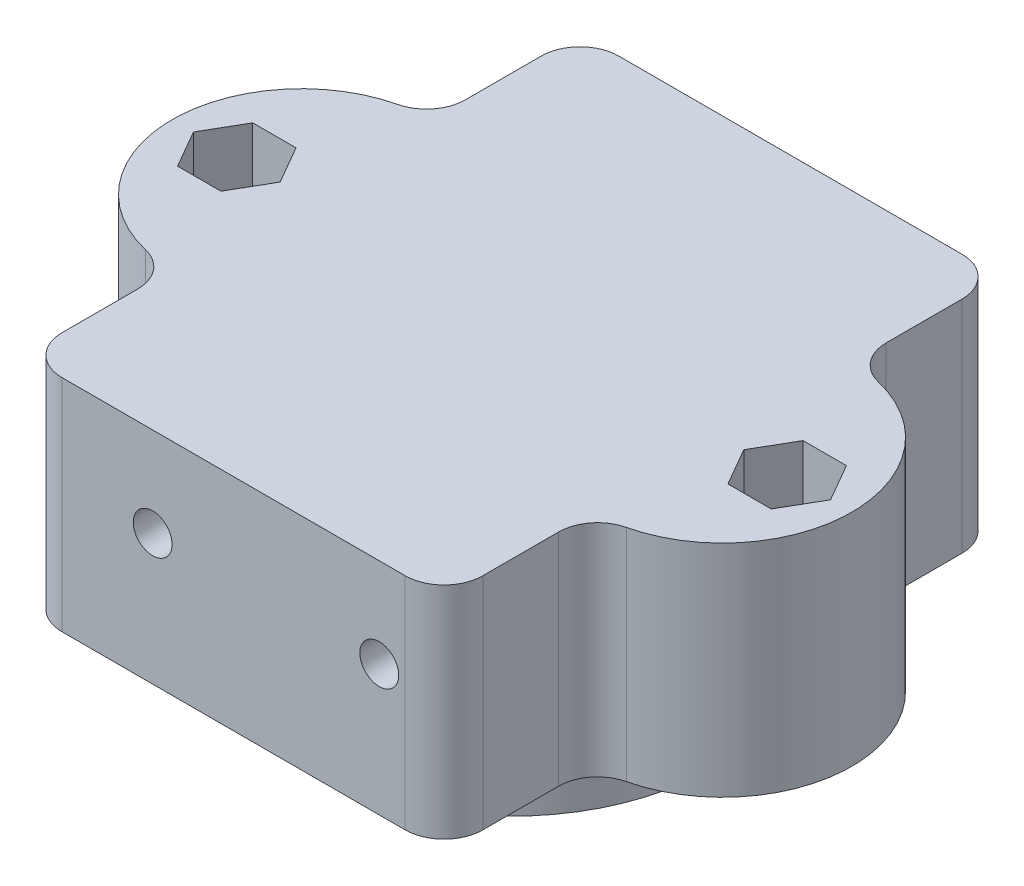
from build123d import *

# Parameters (mm, degrees)
ESQUISSE1_W         = 32.5
ESQUISSE1_H         = 43
ESQUISSE1_R         = 11.9
BOSS_EXTRU_1_DEPTH  = 12
SKETCH2_W           = 32.5
SKETCH2_H           = 43
BOSS_EXTRUDE1_DEPTH = 5
SKETCH3_R           = 1.5
CUT_EXTRUDE2_DEPTH  = 10
BOSS_EXTRUDE2_DEPTH = 17
SKETCH5_R           = 1.75
CUT_EXTRUDE3_DEPTH  = 48.797930062
SKETCH5_3_R         = 1.75
CUT_EXTRUDE4_DEPTH  = 10
BOSS_EXTRUDE3_START = 5.5
SKETCH6_R           = 11.9
BOSS_EXTRUDE3_DEPTH = 5.5
FILLET1_R           = 3
BOSS_EXTRUDE4_START = 5.5
SKETCH7_R           = 15.5
SKETCH7_R_2         = 11.9
BOSS_EXTRUDE4_DEPTH = 5.5
FILLET2_R           = 3


with BuildPart() as part:
    # Esquisse1 → Boss.-Extru.1 (new body)
    with BuildSketch(Plane(origin=(0, 0, 0), x_dir=(1, 0, 0), z_dir=(0, 1, 0))):
        with Locations((0, -14.646640483)):
            Rectangle(ESQUISSE1_W, ESQUISSE1_H)
        with Locations(Location((0, -14.646640483, 0), (0, 0, 270))):
            Circle(ESQUISSE1_R, mode=Mode.SUBTRACT)
    extrude(amount=BOSS_EXTRU_1_DEPTH)

    # Sketch2 → Boss-Extrude1 (add)
    with BuildSketch(Plane(origin=(0, 12, 0), x_dir=(1, 0, 0), z_dir=(0, 1, 0))):
        with Locations((0, -14.646640483)):
            Rectangle(SKETCH2_W, SKETCH2_H)
    extrude(amount=BOSS_EXTRUDE1_DEPTH)

    # Sketch3 → Cut-Extrude2 (cut)
    with BuildSketch(Plane.XY.offset(36.146640483)):
        with Locations((11.25, 10.086854916)):
            Circle(SKETCH3_R)
        with Locations((-6.25, 10.086854916)):
            Circle(SKETCH3_R)
    cut_extrude2 = extrude(amount=-CUT_EXTRUDE2_DEPTH, mode=Mode.SUBTRACT)

    # Mirror1: Cut-Extrude2 across plane
    add(cut_extrude2.mirror(Plane.XY.offset(14.646640483)), mode=Mode.SUBTRACT)

    # Sketch4 → Boss-Extrude2 (add)
    with BuildSketch(Plane(origin=(0, 17, 0), x_dir=(1, 0, 0), z_dir=(0, 1, 0))):
        with BuildLine():
            Line((16.25, -4.646640483), (16.25, -24.646640483))
            ThreePointArc((16.25, -24.646640483), (26.25, -14.646640483), (16.25, -4.646640483))
        make_face()
        with BuildLine():
            Line((-16.25, -4.646640483), (-16.25, -24.646640483))
            ThreePointArc((-16.25, -24.646640483), (-26.25, -14.646640483), (-16.25, -4.646640483))
        make_face()
    extrude(amount=-BOSS_EXTRUDE2_DEPTH)

    # Sketch5 → Cut-Extrude3 (cut, through all)
    with BuildSketch(Plane(origin=(0, 17, 0), x_dir=(1, 0, 0), z_dir=(0, 1, 0))):
        with Locations(Location((-21.25, -14.646640483, 0), (0, 0, 270))):
            Circle(SKETCH5_R)
        with Locations(Location((21.25, -14.646640483, 0), (0, 0, 270))):
            Circle(SKETCH5_R)
    extrude(amount=-CUT_EXTRUDE3_DEPTH, mode=Mode.SUBTRACT)

    # Sketch5<3> → Cut-Extrude4 (cut)
    # profile 1 of 2: a face of its own
    with BuildSketch(Plane(origin=(0, 17, 0), x_dir=(1, 0, 0), z_dir=(0, 1, 0))):
        Polygon((22.924315781, -17.546640483), (24.598631561, -14.646640483), (22.924315781, -11.746640483), (19.575684219, -11.746640483), (17.901368439, -14.646640483), (19.575684219, -17.546640483), align=None)
        with Locations(Location((21.25, -14.646640483, 0), (0, 0, 270))):
            Circle(SKETCH5_3_R, mode=Mode.SUBTRACT)
    # profile 2 of 2: a face of its own
    with BuildSketch(Plane(origin=(0, 17, 0), x_dir=(1, 0, 0), z_dir=(0, 1, 0))):
        Polygon((-19.575684219, -17.546640483), (-22.924315781, -17.546640483), (-24.598631561, -14.646640483), (-22.924315781, -11.746640483), (-19.575684219, -11.746640483), (-17.901368439, -14.646640483), align=None)
        with Locations(Location((-21.25, -14.646640483, 0), (0, 0, 270))):
            Circle(SKETCH5_3_R, mode=Mode.SUBTRACT)
    extrude(amount=-CUT_EXTRUDE4_DEPTH, mode=Mode.SUBTRACT)

    # Sketch6 → Boss-Extrude3 (add)
    with BuildSketch(Plane.XZ.offset(-12).offset(BOSS_EXTRUDE3_START)):
        with Locations(Location((0, 14.646640483, 0), (0, 0, 270))):
            Circle(SKETCH6_R)
    extrude(amount=-BOSS_EXTRUDE3_DEPTH)

    # Fillet1
    fillet1_edges = [part.edges().sort_by_distance(p)[0] for p in [
        (16.25, 8.5, 4.646640483),
        (16.25, 8.5, 24.646640483),
        (-16.25, 8.5, 24.646640483),
        (-16.25, 8.5, 4.646640483),
        (16.25, 8.5, 36.146640483),
        (-16.25, 8.5, 36.146640483),
        (-16.25, 8.5, -6.853359517),
        (16.25, 8.5, -6.853359517),
    ]]
    fillet(fillet1_edges, radius=FILLET1_R)

    # Sketch7 → Boss-Extrude4 (add)
    with BuildSketch(Plane.XZ.offset(BOSS_EXTRUDE4_START)):
        with Locations(Location((0, 14.646640483, 0), (0, 0, 90))):
            Circle(SKETCH7_R)
        with Locations(Location((0, 14.646640483, 0), (0, 0, 270))):
            Circle(SKETCH7_R_2, mode=Mode.SUBTRACT)
    extrude(amount=-BOSS_EXTRUDE4_DEPTH)

    # Fillet2
    fillet2_edges = [part.edges().sort_by_distance(p)[0] for p in [
        (0, 0, -0.853359517),
    ]]
    fillet(fillet2_edges, radius=FILLET2_R)


solid = part.part
